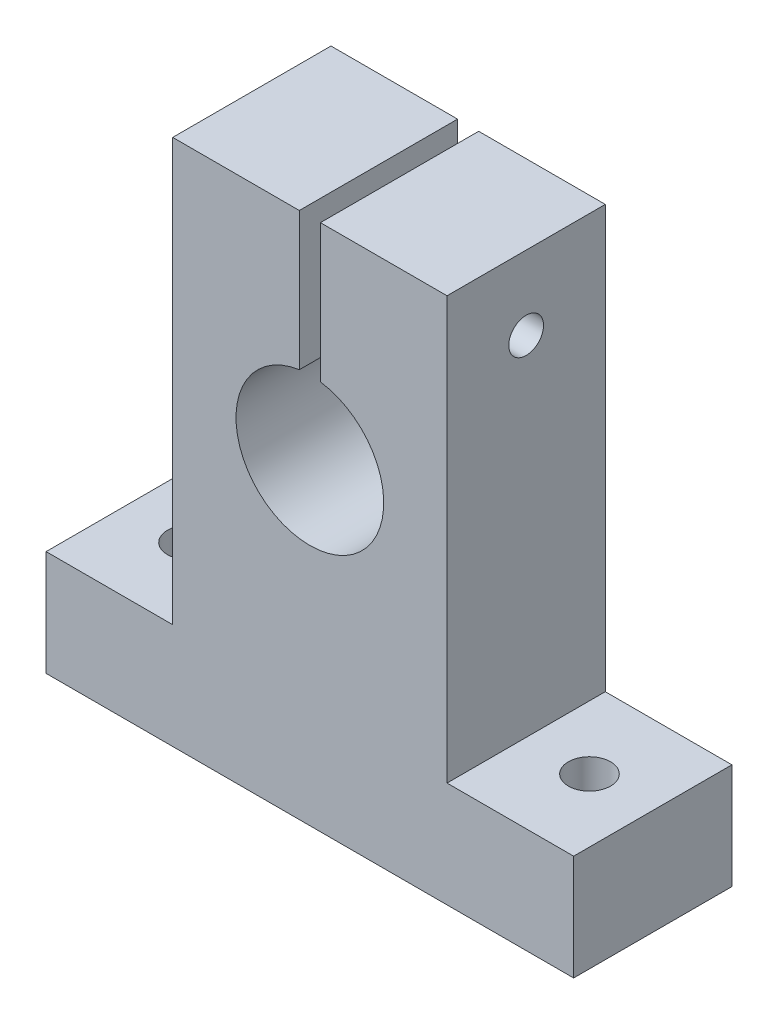
from build123d import *

# Parameters (mm, degrees)
BOSS_EXTRUDE1_DEPTH                                = 15
SKETCH5_R                                          = 2
CUT_EXTRUDE3_DEPTH                                 = 15
CHAMBRAGE_POUR_VIS_T_TE_HEXAGONALE_M41_D           = 4.3
CHAMBRAGE_POUR_VIS_T_TE_HEXAGONALE_M41_DEPTH       = 12
CHAMBRAGE_POUR_VIS_T_TE_HEXAGONALE_M41_CBORE_D     = 8
CHAMBRAGE_POUR_VIS_T_TE_HEXAGONALE_M41_CBORE_DEPTH = 4.4
TROU_TARAUD_M41_D                                  = 3.3


with BuildPart() as part:
    # Sketch1 → Boss-Extrude1 (new body)
    with BuildSketch(Plane.XY):
        with BuildLine():
            Line((-26, 0), (-26, -40))
            Line((-26, -40), (-38, -40))
            Line((-38, -40), (-38, -50))
            Line((-38, -50), (12, -50))
            Line((12, -50), (12, -40))
            Line((12, -40), (0, -40))
            Line((0, -40), (0, 0))
            Line((0, 0), (-12, 0))
            Line((-12, 0), (-12, -13.07179677))
            ThreePointArc((-12, -13.07179677), (-13, -27), (-14, -13.07179677))
            Line((-14, -13.07179677), (-14, 0))
            Line((-14, 0), (-26, 0))
        make_face()
    extrude(amount=BOSS_EXTRUDE1_DEPTH)

    # Sketch5 → Cut-Extrude3 (cut)
    with BuildSketch(Plane(origin=(0, -40, 0), x_dir=(1, 0, 0), z_dir=(0, 1, 0))):
        with Locations(Location((6, -7.5, 0), (0, 0, 270))):
            Circle(SKETCH5_R)
        with Locations(Location((-32, -7.5, 0), (0, 0, 270))):
            Circle(SKETCH5_R)
    extrude(amount=-CUT_EXTRUDE3_DEPTH, mode=Mode.SUBTRACT)

    # Chambrage pour vis à tête hexagonale M41
    with Locations(Plane.ZY.offset(26)):
        with Locations((7.569852971, -7)):
            CounterBoreHole(CHAMBRAGE_POUR_VIS_T_TE_HEXAGONALE_M41_D / 2, CHAMBRAGE_POUR_VIS_T_TE_HEXAGONALE_M41_CBORE_D / 2, CHAMBRAGE_POUR_VIS_T_TE_HEXAGONALE_M41_CBORE_DEPTH, depth=CHAMBRAGE_POUR_VIS_T_TE_HEXAGONALE_M41_DEPTH)

    # Trou taraudé M41 (through all)
    with Locations(Plane(origin=(0, 0, 0), x_dir=(0, 0, -1), z_dir=(1, 0, 0))):
        with Locations((-7.5, -7)):
            Hole(TROU_TARAUD_M41_D / 2)


solid = part.part
